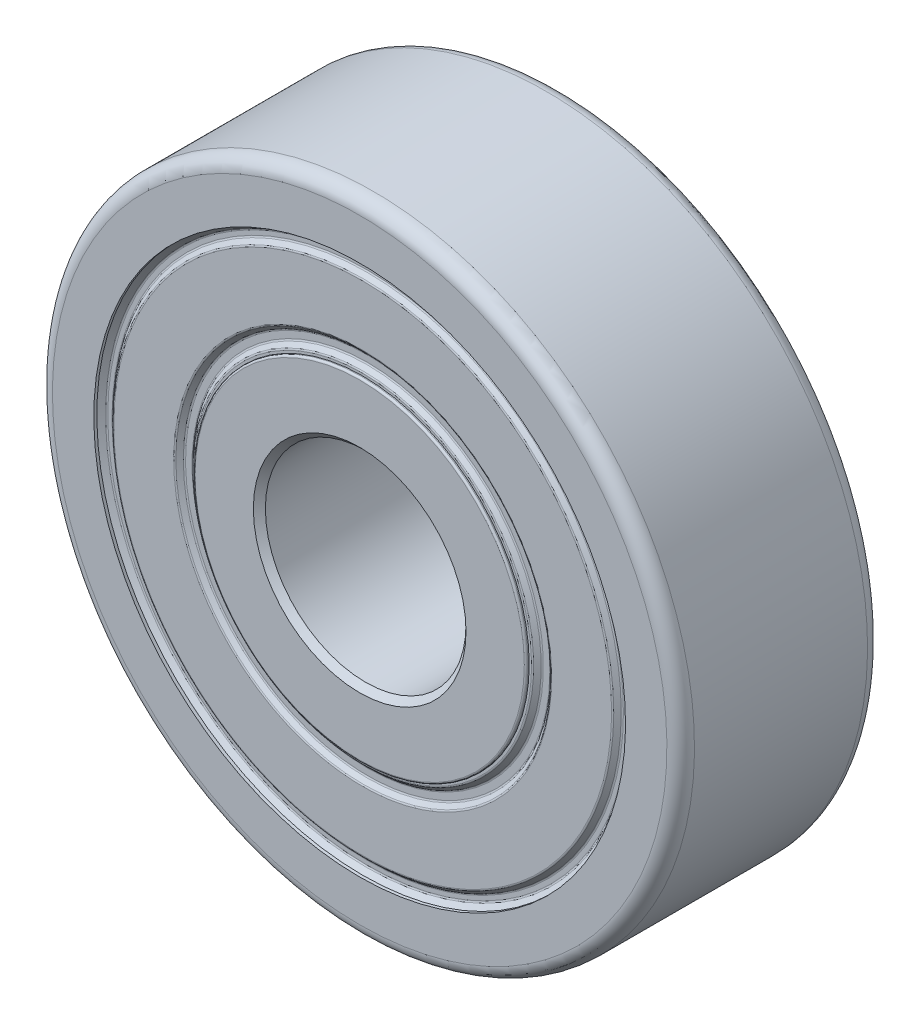
from build123d import *

# Parameters (mm, degrees)
CHAMFER1_SIZE     = 0.15
FILLET2_R         = 0.055
CIRPATTERN1_COUNT = 6
FILLET3_R         = 0.048


with BuildPart() as part:
    # Sketch3 → Revolve1 (revolve)
    with BuildSketch(Plane(origin=(0, 0, 0), x_dir=(0, 0, -1), z_dir=(1, 0, 0)), mode=Mode.PRIVATE) as revolve1_sk:
        with BuildLine():
            Line((-2.5, 2.5), (2.5, 2.5))
            Line((2.5, 2.5), (2.5, 4.15))
            Line((2.5, 4.15), (0.984350198, 4.15))
            ThreePointArc((0.984350198, 4.15), (0, 3.80625), (-0.984350198, 4.15))
            Line((-0.984350198, 4.15), (-2.5, 4.15))
            Line((-2.5, 4.15), (-2.5, 2.5))
        make_face()
        with BuildLine():
            Line((2.5, 6.625), (2.425, 6.625))
            ThreePointArc((2.425, 6.625), (2.310894468, 6.749524337), (2.176899031, 6.646706022))
            Line((2.176899031, 6.646706022), (2.102540881, 6.225))
            Line((2.102540881, 6.225), (1.34124767, 6.225))
            ThreePointArc((1.34124767, 6.225), (0, 6.96875), (-1.34124767, 6.225))
            Line((-1.34124767, 6.225), (-2.102540881, 6.225))
            Line((-2.102540881, 6.225), (-2.176899031, 6.646706022))
            ThreePointArc((-2.176899031, 6.646706022), (-2.310894468, 6.749524337), (-2.425, 6.625))
            Line((-2.425, 6.625), (-2.5, 6.625))
            Line((-2.5, 6.625), (-2.5, 7.65625))
            ThreePointArc((-2.5, 7.65625), (-2.399317956, 7.899317956), (-2.15625, 8))
            Line((-2.15625, 8), (2.15625, 8))
            ThreePointArc((2.15625, 8), (2.399317956, 7.899317956), (2.5, 7.65625))
            Line((2.5, 7.65625), (2.5, 6.625))
        make_face()
    revolve(revolve1_sk.sketch.rotate(Axis((0, 0, 2.5), (0, 0, -1)), 180), axis=Axis((0, 0, 2.5), (0, 0, -1)))

    # Chamfer1
    chamfer1_edges = [part.edges().sort_by_distance(p)[0] for p in [
        (0, 2.5, -2.5),
        (0, 2.5, 2.5),
    ]]
    chamfer(chamfer1_edges, length=CHAMFER1_SIZE)

    # Fillet3
    fillet3_edges = [part.edges().sort_by_distance(p)[0] for p in [
        (0, 4.15, 2.5),
        (0, 4.15, -2.5),
    ]]
    fillet(fillet3_edges, radius=FILLET3_R)


with BuildPart() as body_2:
    # Sketch4 → Revolve2 (revolve)
    with BuildSketch(Plane(origin=(0, 0, 0), x_dir=(0, 0, -1), z_dir=(1, 0, 0)), mode=Mode.PRIVATE) as revolve2_sk:
        with BuildLine():
            Line((-2.176899031, 6.646706022), (-2.176899031, 4.15))
            Line((-2.176899031, 4.15), (-2.3, 4.15))
            Line((-2.3, 4.15), (-2.425, 4.15))
            Line((-2.425, 4.15), (-2.425, 4.23125))
            Line((-2.425, 4.23125), (-2.3, 4.35625))
            Line((-2.3, 4.35625), (-2.3, 4.5625))
            Line((-2.3, 4.5625), (-2.425, 4.6875))
            Line((-2.425, 4.6875), (-2.425, 6.225))
            Line((-2.425, 6.225), (-2.3, 6.35))
            Line((-2.3, 6.35), (-2.3, 6.5))
            Line((-2.3, 6.5), (-2.425, 6.625))
            ThreePointArc((-2.425, 6.625), (-2.310894468, 6.749524337), (-2.176899031, 6.646706022))
        make_face()
    revolve(revolve2_sk.sketch.rotate(Axis((0, 0, 2.5), (0, 0, -1)), 180), axis=Axis((0, 0, 2.5), (0, 0, -1)))

    # Fillet2
    fillet2_edges = [body_2.edges().sort_by_distance(p)[0] for p in [
        (0, 4.23125, 2.425),
        (0, 4.35625, 2.3),
        (0, 4.5625, 2.3),
        (0, 4.6875, 2.425),
        (0, 6.225, 2.425),
        (0, 6.35, 2.3),
        (0, 6.5, 2.3),
    ]]
    fillet(fillet2_edges, radius=FILLET2_R)


with BuildPart() as body_3:
    # Sketch5 → Revolve3 (revolve)
    with BuildSketch(Plane(origin=(0, 0, 0), x_dir=(0, 0, -1), z_dir=(1, 0, 0))):
        with BuildLine():
            Line((0, 6.96875), (0, 3.80625))
            ThreePointArc((0, 3.80625), (1.58125, 5.3875), (0, 6.96875))
        make_face()
    revolve(axis=Axis((0, 6.96875, 0), (0, -1, 0)))


with BuildPart() as cirpattern1_1:
    # CirPattern1: pattern copy
    add(body_3.part.rotate(Axis((0, 0, 0), (0, 0, 1)), 1 * 360 / CIRPATTERN1_COUNT))


with BuildPart() as cirpattern1_2:
    # CirPattern1: pattern copy
    add(body_3.part.rotate(Axis((0, 0, 0), (0, 0, 1)), 2 * 360 / CIRPATTERN1_COUNT))


with BuildPart() as cirpattern1_3:
    # CirPattern1: pattern copy
    add(body_3.part.rotate(Axis((0, 0, 0), (0, 0, 1)), 3 * 360 / CIRPATTERN1_COUNT))


with BuildPart() as cirpattern1_4:
    # CirPattern1: pattern copy
    add(body_3.part.rotate(Axis((0, 0, 0), (0, 0, 1)), 4 * 360 / CIRPATTERN1_COUNT))


with BuildPart() as cirpattern1_5:
    # CirPattern1: pattern copy
    add(body_3.part.rotate(Axis((0, 0, 0), (0, 0, 1)), 5 * 360 / CIRPATTERN1_COUNT))


with BuildPart() as body_9:
    # Mirror2: mirrored copy
    add(body_2.part.mirror(Plane.XY))


solid = Compound([part.part, body_2.part, body_3.part, cirpattern1_1.part, cirpattern1_2.part, cirpattern1_3.part, cirpattern1_4.part, cirpattern1_5.part, body_9.part])
